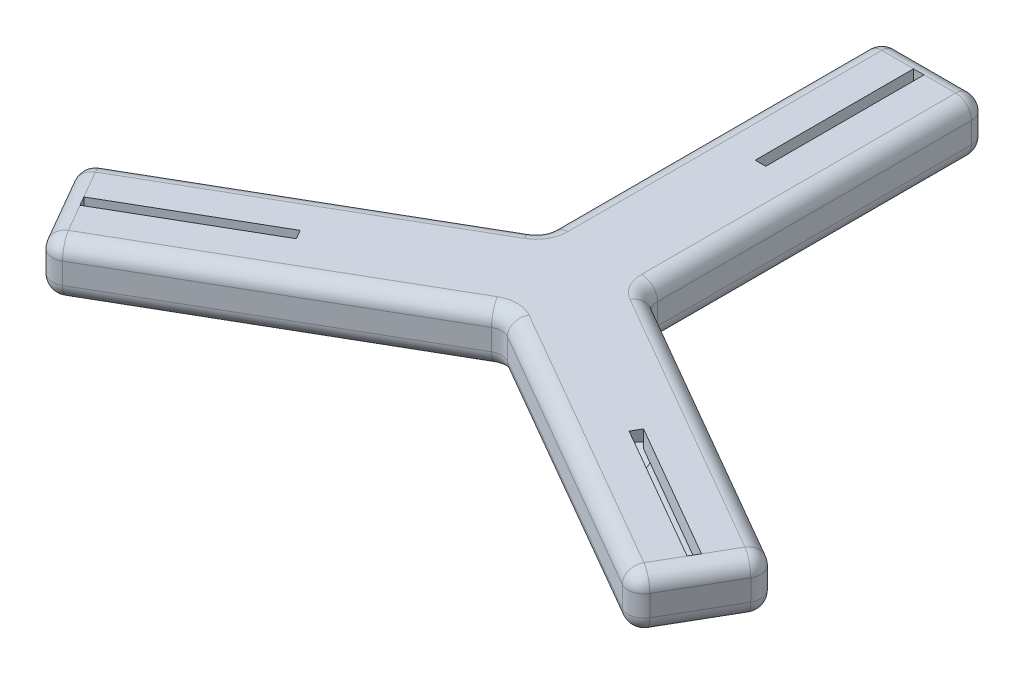
from build123d import *

# Parameters (mm, degrees)
BOSS_EXTRUDE1_DEPTH = 10
FILLET3_R           = 3
CUT_EXTRUDE8_START  = -33
SKETCH8_R           = 2
CUT_EXTRUDE8_DEPTH  = 197.665485806
SKETCH11_R          = 3
CUT_EXTRUDE9_DEPTH  = 35
SKETCH7_W           = 2
SKETCH7_H           = 30
CUT_EXTRUDE10_DEPTH = 5
CUT_EXTRUDE11_DEPTH = 5
CUT_EXTRUDE12_DEPTH = 5
CIRPATTERN8_COUNT   = 3
SKETCH17_W          = 14
SKETCH17_H          = 4
BOSS_EXTRUDE3_DEPTH = 3
CIRPATTERN9_COUNT   = 3


with BuildPart() as part:
    # Sketch2 → Boss-Extrude1 (new body)
    with BuildSketch(Plane(origin=(0, 0, 0), x_dir=(1, 0, 0), z_dir=(0, 1, 0))):
        Polygon((10, 5.773502692), (10, 70), (-10, 70), (-10, 5.773502692), (-65.621778265, -26.339745962), (-55.621778265, -43.660254038), (0, -11.547005384), (55.621778265, -43.660254038), (65.621778265, -26.339745962), align=None)
    extrude(amount=BOSS_EXTRUDE1_DEPTH)

    # Fillet3
    fillet3_edges = [part.edges().sort_by_distance(p)[0] for p in [
        (-10, 5, -70),
        (10, 5, -70),
        (65.621778265, 5, 26.339745962),
        (55.621778265, 5, 43.660254038),
        (-65.621778265, 5, 26.339745962),
        (-55.621778265, 5, 43.660254038),
        (10, 10, -37.886751346),
        (10, 5, -5.773502692),
        (37.810889132, 0, 10.283121635),
        (10, 0, -37.886751346),
        (60.621778265, 0, 35),
        (60.621778265, 10, 35),
        (27.810889132, 0, 27.603629711),
        (0, 5, 11.547005384),
        (-27.810889132, 0, 27.603629711),
        (-10, 5, -5.773502692),
        (-37.810889132, 0, 10.283121635),
        (-10, 0, -37.886751346),
        (-60.621778265, 10, 35),
        (-60.621778265, 0, 35),
        (0, 0, -70),
        (0, 10, -70),
        (37.810889132, 10, 10.283121635),
        (27.810889132, 10, 27.603629711),
        (-27.810889132, 10, 27.603629711),
        (-37.810889132, 10, 10.283121635),
        (-10, 10, -37.886751346),
    ]]
    fillet(fillet3_edges, radius=FILLET3_R)

    # Sketch8 → Cut-Extrude8 (cut)
    with BuildSketch(Plane(origin=(60.621778265, 0, 35), x_dir=(0.49999999999999983, 0, -0.8660254037844388), z_dir=(0.8660254037844387, 0, 0.4999999999999998)).offset(CUT_EXTRUDE8_START)):
        with Locations((0, 5)):
            Circle(SKETCH8_R)
    cut_extrude8 = extrude(amount=CUT_EXTRUDE8_DEPTH, mode=Mode.SUBTRACT)

    # Sketch11 → Cut-Extrude9 (cut)
    with BuildSketch(Plane(origin=(32.04293994, 0, 18.5), x_dir=(0.49999999999999994, 0, -0.8660254037844387), z_dir=(0.8660254037844386, 0, 0.4999999999999999))):
        with Locations((0, 5)):
            Circle(SKETCH11_R)
    cut_extrude9 = extrude(amount=-CUT_EXTRUDE9_DEPTH, mode=Mode.SUBTRACT)

    # Sketch7 → Cut-Extrude10 (cut)
    with BuildSketch(Plane(origin=(0, 10, 0), x_dir=(1, 0, 0), z_dir=(0, 1, 0))):
        with Locations((0.025333085, 52)):
            Rectangle(SKETCH7_W, SKETCH7_H)
    extrude(amount=-CUT_EXTRUDE10_DEPTH, mode=Mode.SUBTRACT)

    # Sketch7<7> → Cut-Extrude11 (cut)
    with BuildSketch(Plane(origin=(0, 10, 0), x_dir=(1, 0, 0), z_dir=(0, 1, 0))):
        Polygon((-32.555606483, -17.612035501), (-58.536368596, -32.612035501), (-57.536368596, -34.344086308), (-31.555606483, -19.344086308), align=None)
    extrude(amount=-CUT_EXTRUDE11_DEPTH, mode=Mode.SUBTRACT)

    # Sketch7<8> → Cut-Extrude12 (cut)
    with BuildSketch(Plane(origin=(0, 10, 0), x_dir=(1, 0, 0), z_dir=(0, 1, 0))):
        Polygon((31.530273397, -19.387964499), (57.511035511, -34.387964499), (58.511035511, -32.655913692), (32.530273397, -17.655913692), align=None)
    extrude(amount=-CUT_EXTRUDE12_DEPTH, mode=Mode.SUBTRACT)

    # CirPattern8: Cut-Extrude8, Cut-Extrude9 ×3 about axis
    cirpattern8_axis = Axis((0, 10, 0), (0, 1, 0))
    add([cut_extrude8.rotate(cirpattern8_axis, i * 360 / CIRPATTERN8_COUNT) for i in range(1, CIRPATTERN8_COUNT)], mode=Mode.SUBTRACT)
    add([cut_extrude9.rotate(cirpattern8_axis, i * 360 / CIRPATTERN8_COUNT) for i in range(1, CIRPATTERN8_COUNT)], mode=Mode.SUBTRACT)

    # Sketch17 → Boss-Extrude3 (add)
    with BuildSketch(Plane(origin=(60.621778265, 0, 35), x_dir=(0.49999999999999983, 0, -0.8660254037844388), z_dir=(0.8660254037844387, 0, 0.4999999999999998))):
        with Locations((0, 5)):
            Rectangle(SKETCH17_W, SKETCH17_H)
    boss_extrude3 = extrude(amount=-BOSS_EXTRUDE3_DEPTH)

    # CirPattern9: Boss-Extrude3 ×3 about axis
    cirpattern9_axis = Axis((0, 10, 0), (0, 1, 0))
    for i in range(1, CIRPATTERN9_COUNT):
        add(boss_extrude3.rotate(cirpattern9_axis, i * 360 / CIRPATTERN9_COUNT))


solid = part.part
